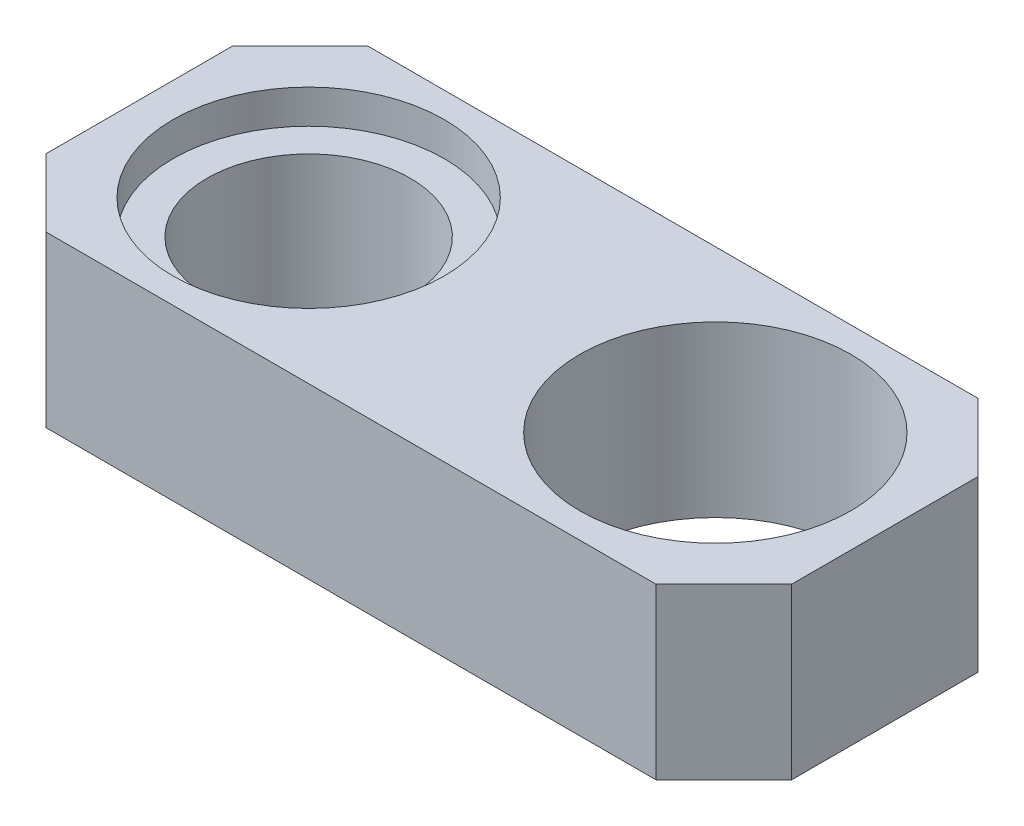
from build123d import *

# Parameters (mm, degrees)
SKETCH_1_W          = 22
SKETCH_1_H          = 9.5
EXTRUDE_1_DEPTH     = 2.5
SKETCH_2_R          = 4
CUT_EXTRUDE_1_DEPTH = 13.983162173
SKETCH_3_R          = 4
CUT_EXTRUDE_2_DEPTH = 1
SKETCH_4_R          = 3
CUT_EXTRUDE_3_DEPTH = 13.631805097
CHAMFER_1_SIZE      = 2


with BuildPart() as part:
    # 草图1 → 凸台-拉伸1 (new, symmetric)
    with BuildSketch(Plane(origin=(0, 0, 0), x_dir=(1, 0, 0), z_dir=(0, 1, 0))):
        Rectangle(SKETCH_1_W, SKETCH_1_H)
    extrude(amount=EXTRUDE_1_DEPTH, both=True)

    # 草图2 → 切除-拉伸1 (cut, through all)
    with BuildSketch(Plane(origin=(0, 2.5, 0), x_dir=(1, 0, 0), z_dir=(0, 1, 0))):
        with Locations(Location((6, 0, 0), (0, 0, 270))):
            Circle(SKETCH_2_R)
    extrude(amount=-CUT_EXTRUDE_1_DEPTH, mode=Mode.SUBTRACT)

    # 草图3 → 切除-拉伸2 (cut)
    with BuildSketch(Plane(origin=(0, 2.5, 0), x_dir=(1, 0, 0), z_dir=(0, 1, 0))):
        with Locations(Location((-6, 0, 0), (0, 0, 270))):
            Circle(SKETCH_3_R)
    extrude(amount=-CUT_EXTRUDE_2_DEPTH, mode=Mode.SUBTRACT)

    # 草图4 → 切除-拉伸3 (cut, through all)
    with BuildSketch(Plane(origin=(0, 1.5, 0), x_dir=(1, 0, 0), z_dir=(0, 1, 0))):
        with Locations(Location((-6, 0, 0), (0, 0, 270))):
            Circle(SKETCH_4_R)
    extrude(amount=-CUT_EXTRUDE_3_DEPTH, mode=Mode.SUBTRACT)

    # 倒角1
    chamfer_1_edges = [part.edges().sort_by_distance(p)[0] for p in [
        (-11, 0, -4.75),
        (11, 0, -4.75),
        (11, 0, 4.75),
        (-11, 0, 4.75),
    ]]
    chamfer(chamfer_1_edges, length=CHAMFER_1_SIZE)


solid = part.part
